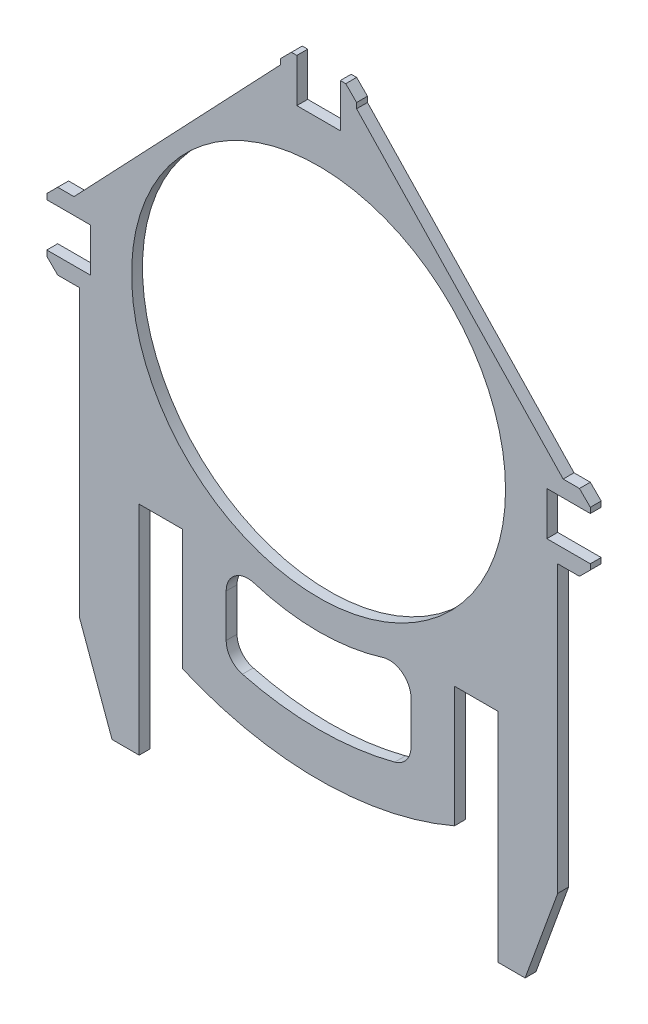
from build123d import *

# Parameters (mm, degrees)
ESQUISSE1_R        = 172
BOSS_EXTRU_1_DEPTH = 10
CONG_1_R           = 20


with BuildPart() as part:
    # Esquisse1 → Boss.-Extru.1 (new body)
    with BuildSketch(Plane.XY):
        with BuildLine():
            Line((220, -297.575677416), (220, -228.230147001))
            Line((220, -228.230147001), (220, -35))
            Line((220, -35), (240, -35))
            Line((240, -35), (250, -25))
            Line((250, -25), (250, -20))
            Line((250, -20), (210, -20))
            Line((210, -20), (210, 20))
            Line((210, 20), (250, 20))
            Line((250, 20), (250, 25))
            Line((250, 25), (240, 35))
            Line((240, 35), (225, 35))
            Line((225, 35), (35, 235))
            Line((35, 235), (35, 240))
            Line((35, 240), (25, 250))
            Line((25, 250), (20, 250))
            Line((20, 250), (20, 210))
            Line((20, 210), (-20, 210))
            Line((-20, 210), (-20, 250))
            Line((-20, 250), (-25, 250))
            Line((-25, 250), (-35, 240))
            Line((-35, 240), (-35, 235))
            Line((-35, 235), (-225, 35))
            Line((-225, 35), (-240, 35))
            Line((-240, 35), (-250, 25))
            Line((-250, 25), (-250, 20))
            Line((-250, 20), (-210, 20))
            Line((-210, 20), (-210, -20))
            Line((-210, -20), (-250, -20))
            Line((-250, -20), (-250, -25))
            Line((-250, -25), (-240, -35))
            Line((-240, -35), (-220, -35))
            Line((-220, -35), (-220, -297.575677416))
            Line((-220, -297.575677416), (-190, -380))
            Line((-190, -380), (-165, -380))
            Line((-165, -380), (-165, -180))
            Line((-165, -180), (-125, -180))
            Line((-125, -180), (-125, -291.314263297))
            ThreePointArc((-125, -291.314263297), (0, -317), (125, -291.314263297))
            Line((125, -291.314263297), (125, -180))
            Line((125, -180), (165, -180))
            Line((165, -180), (165, -380))
            Line((165, -380), (190, -380))
            Line((190, -380), (220, -297.575677416))
        make_face()
        with BuildLine():
            Line((-85, -263.636112853), (-85, -180))
            ThreePointArc((-85, -180), (0, -199.060292374), (85, -180))
            Line((85, -180), (85, -263.636112853))
            ThreePointArc((85, -263.636112853), (0, -277), (-85, -263.636112853))
        make_face(mode=Mode.SUBTRACT)
        Circle(ESQUISSE1_R, mode=Mode.SUBTRACT)
    extrude(amount=BOSS_EXTRU_1_DEPTH)

    # Congé1
    cong_1_edges = [part.edges().sort_by_distance(p)[0] for p in [
        (-85, -263.636112853, 5),
        (85, -263.636112853, 5),
        (85, -180, 5),
        (-85, -180, 5),
    ]]
    fillet(cong_1_edges, radius=CONG_1_R)


solid = part.part
